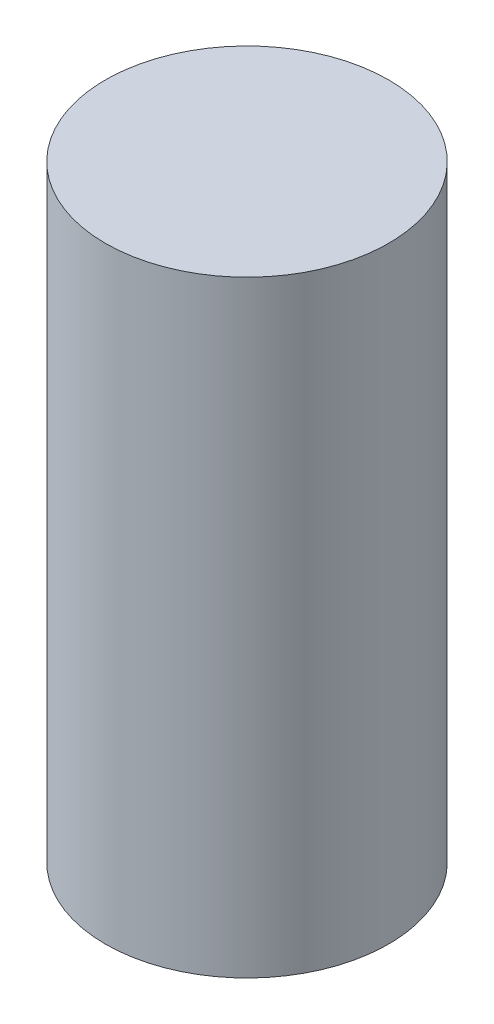
from build123d import *

# Parameters (mm, degrees)
SKETCH1_R           = 70
BOSS_EXTRUDE1_DEPTH = 300


with BuildPart() as part:
    # Sketch1 → Boss-Extrude1 (new body)
    with BuildSketch(Plane(origin=(0, 0, 0), x_dir=(1, 0, 0), z_dir=(0, 1, 0))):
        with Locations(Location((0, 0, 0), (0, 0, 270))):
            Circle(SKETCH1_R)
    extrude(amount=BOSS_EXTRUDE1_DEPTH)


solid = part.part
